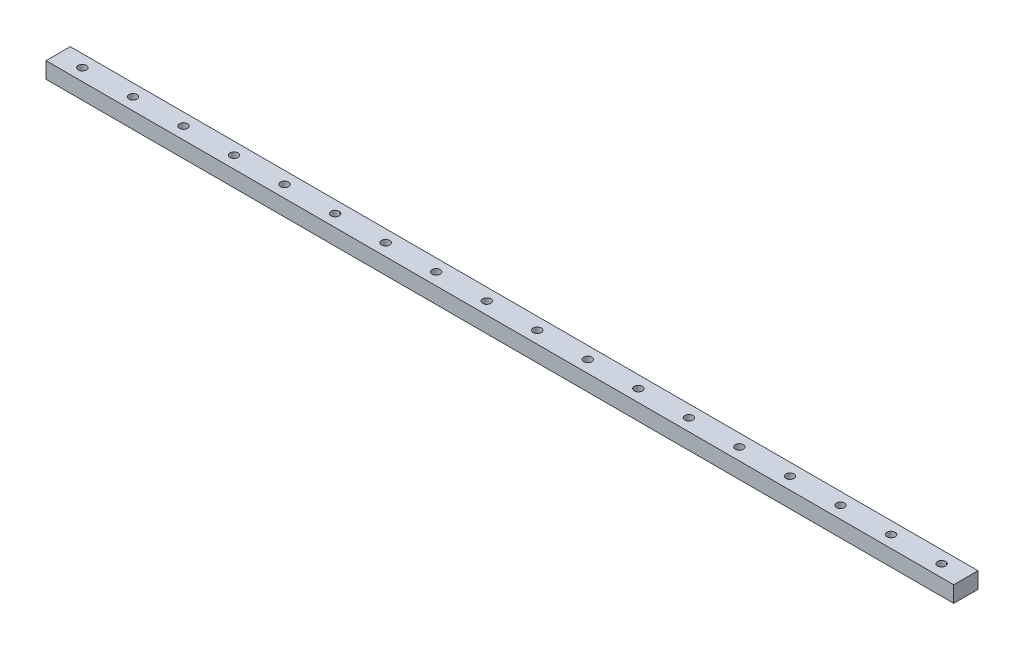
from build123d import *

# Parameters (mm, degrees)
SKETCH1_W           = 449
SKETCH1_H           = 12
SKETCH1_R           = 2
BOSS_EXTRUDE1_DEPTH = 8


with BuildPart() as part:
    # Sketch1 → Boss-Extrude1 (new body)
    with BuildSketch(Plane(origin=(0, 0, 0), x_dir=(1, 0, 0), z_dir=(0, 1, 0))):
        with Locations((224.5, 6)):
            Rectangle(SKETCH1_W, SKETCH1_H)
        with Locations(Location((12, 6, 0), (0, 0, 270))):
            Circle(SKETCH1_R, mode=Mode.SUBTRACT)
        with Locations(Location((37, 6, 0), (0, 0, 270))):
            Circle(SKETCH1_R, mode=Mode.SUBTRACT)
        with Locations(Location((62, 6, 0), (0, 0, 270))):
            Circle(SKETCH1_R, mode=Mode.SUBTRACT)
        with Locations(Location((87, 6, 0), (0, 0, 270))):
            Circle(SKETCH1_R, mode=Mode.SUBTRACT)
        with Locations(Location((112, 6, 0), (0, 0, 270))):
            Circle(SKETCH1_R, mode=Mode.SUBTRACT)
        with Locations(Location((137, 6, 0), (0, 0, 270))):
            Circle(SKETCH1_R, mode=Mode.SUBTRACT)
        with Locations(Location((162, 6, 0), (0, 0, 270))):
            Circle(SKETCH1_R, mode=Mode.SUBTRACT)
        with Locations(Location((187, 6, 0), (0, 0, 270))):
            Circle(SKETCH1_R, mode=Mode.SUBTRACT)
        with Locations(Location((212, 6, 0), (0, 0, 270))):
            Circle(SKETCH1_R, mode=Mode.SUBTRACT)
        with Locations(Location((237, 6, 0), (0, 0, 270))):
            Circle(SKETCH1_R, mode=Mode.SUBTRACT)
        with Locations(Location((262, 6, 0), (0, 0, 270))):
            Circle(SKETCH1_R, mode=Mode.SUBTRACT)
        with Locations(Location((287, 6, 0), (0, 0, 270))):
            Circle(SKETCH1_R, mode=Mode.SUBTRACT)
        with Locations(Location((312, 6, 0), (0, 0, 270))):
            Circle(SKETCH1_R, mode=Mode.SUBTRACT)
        with Locations(Location((337, 6, 0), (0, 0, 270))):
            Circle(SKETCH1_R, mode=Mode.SUBTRACT)
        with Locations(Location((362, 6, 0), (0, 0, 270))):
            Circle(SKETCH1_R, mode=Mode.SUBTRACT)
        with Locations(Location((387, 6, 0), (0, 0, 270))):
            Circle(SKETCH1_R, mode=Mode.SUBTRACT)
        with Locations(Location((412, 6, 0), (0, 0, 270))):
            Circle(SKETCH1_R, mode=Mode.SUBTRACT)
        with Locations(Location((437, 6, 0), (0, 0, 270))):
            Circle(SKETCH1_R, mode=Mode.SUBTRACT)
    extrude(amount=BOSS_EXTRUDE1_DEPTH)


solid = part.part
